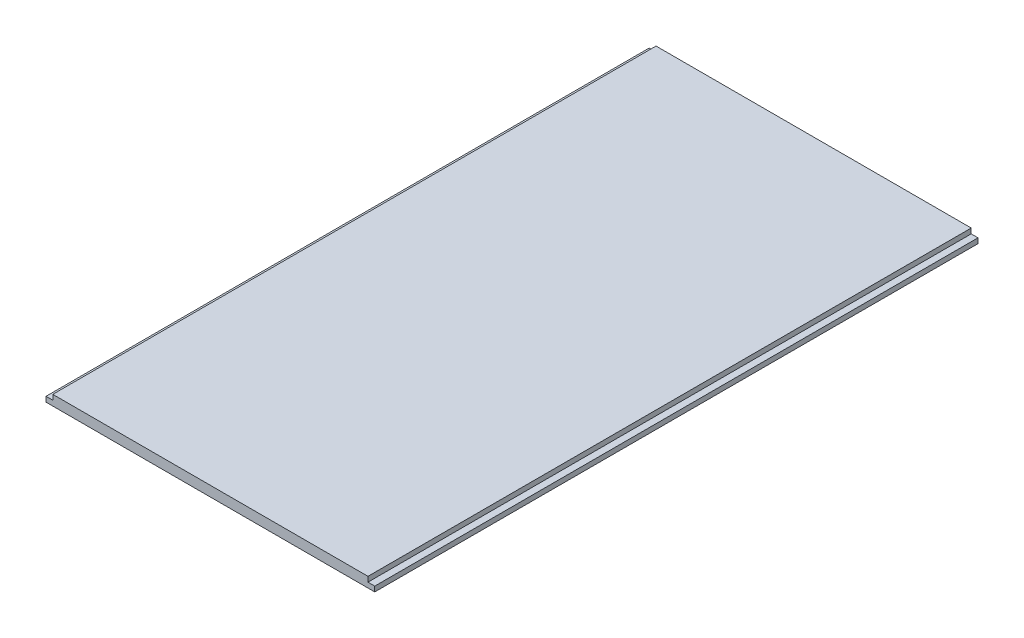
from build123d import *

# Parameters (mm, degrees)
EXTRUDE_1_DEPTH = 178


with BuildPart() as part:
    # 草图1 → 凸台-拉伸1 (new body)
    with BuildSketch(Plane.XY):
        Polygon((48.5, 0), (-48.5, 0), (-48.5, 1.5), (-46.5, 1.5), (-46.5, 3), (46.5, 3), (46.5, 1.5), (48.5, 1.5), align=None)
    extrude(amount=EXTRUDE_1_DEPTH)


solid = part.part
